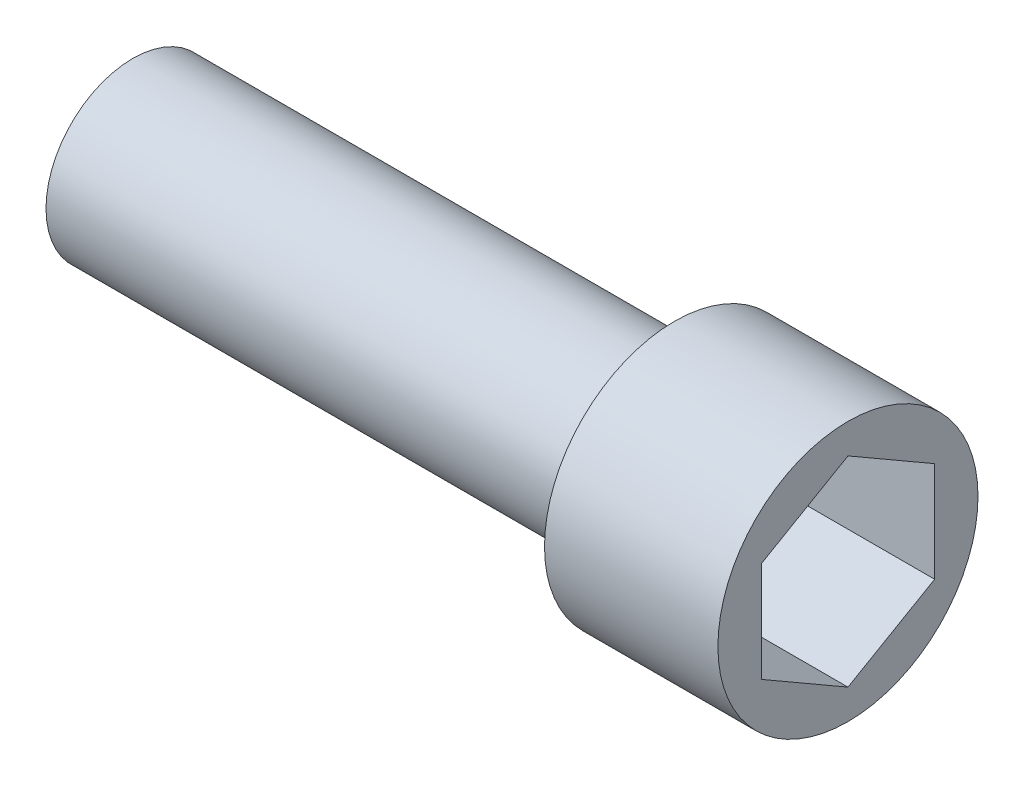
from build123d import *

# Parameters (mm, degrees)
SKETCH2_R           = 6
BOSS_EXTRUDE1_DEPTH = 8
SKETCH4_R           = 4
BOSS_EXTRUDE2_DEPTH = 25
CUT_EXTRUDE1_DEPTH  = 7


with BuildPart() as part:
    # Sketch2 → Boss-Extrude1 (new body)
    with BuildSketch(Plane(origin=(0, 0, 0), x_dir=(0, 0, -1), z_dir=(1, 0, 0))):
        Circle(SKETCH2_R)
    extrude(amount=BOSS_EXTRUDE1_DEPTH)

    # Sketch4 → Boss-Extrude2 (add)
    with BuildSketch(Plane.ZY):
        Circle(SKETCH4_R)
    extrude(amount=BOSS_EXTRUDE2_DEPTH)

    # Sketch3 → Cut-Extrude1 (cut)
    with BuildSketch(Plane(origin=(8, 0, 0), x_dir=(0, 0, -1), z_dir=(1, 0, 0))):
        Polygon((4, 2.309401077), (0, 4.618802154), (-4, 2.309401077), (-4, -2.309401077), (0, -4.618802154), (4, -2.309401077), align=None)
    extrude(amount=-CUT_EXTRUDE1_DEPTH, mode=Mode.SUBTRACT)


solid = part.part
